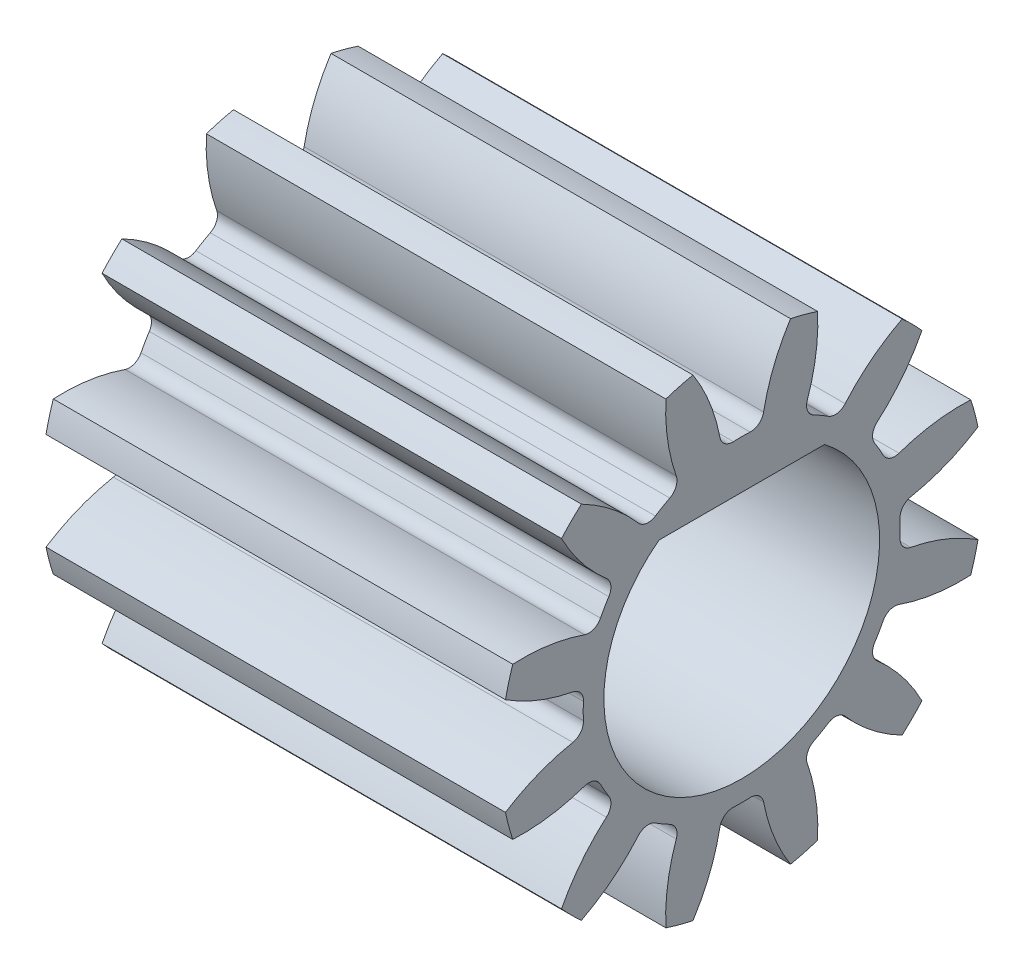
from build123d import *

# Parameters (mm, degrees)
SKETCH1_R                = 5.25
SKETCH1_R_2              = 3
BOSS_EXTRUDE2_DEPTH      = 10
CUT_EXTRUDE1_DEPTH       = 13.454918707
FILLET1_R                = 0.285
CIRPATTERN2_COUNT        = 12
FILLET1_OF_CIRPATTERN2_R = 0.285
BOSS_EXTRUDE3_DEPTH      = 10


with BuildPart() as part:
    # Sketch1 → Boss-Extrude2 (new body)
    with BuildSketch(Plane(origin=(0, 0, 0), x_dir=(0, 0, -1), z_dir=(1, 0, 0))):
        Circle(SKETCH1_R)
        Circle(SKETCH1_R_2, mode=Mode.SUBTRACT)
    extrude(amount=BOSS_EXTRUDE2_DEPTH)

    # Sketch3 → Cut-Extrude1 (cut, through all)
    with BuildSketch(Plane(origin=(10, 0, 0), x_dir=(0, 0, -1), z_dir=(1, 0, 0))):
        with BuildLine():
            ThreePointArc((0.435664459, 3.422381697), (0, 3.45), (-0.435664459, 3.422381697))
            ThreePointArc((-0.435664459, 3.422381697), (-0.652529527, 4.316927443), (-1.061404169, 5.141587419))
            ThreePointArc((-1.061404169, 5.141587419), (0, 5.25), (1.061404169, 5.141587419))
            ThreePointArc((1.061404169, 5.141587419), (0.652529527, 4.316927443), (0.435664459, 3.422381697))
        make_face()
    cut_extrude1 = extrude(amount=-CUT_EXTRUDE1_DEPTH, mode=Mode.SUBTRACT)

    # Fillet1
    fillet1_edges = [part.edges().sort_by_distance(p)[0] for p in [
        (5, 3.422381697, 0.435664459),
        (5, 3.422381697, -0.435664459),
    ]]
    fillet(fillet1_edges, radius=FILLET1_R)

    # CirPattern2: Cut-Extrude1 ×12 about axis
    cirpattern2_axis = Axis((0, 0, 0), (1, 0, 0))
    for i in range(1, CIRPATTERN2_COUNT):
        add(cut_extrude1.rotate(cirpattern2_axis, i * 360 / CIRPATTERN2_COUNT), mode=Mode.SUBTRACT)

    # Fillet1 of CirPattern2
    fillet1_of_cirpattern2_edges = [part.edges().sort_by_distance(p)[0] for p in [
        (5, 2.746037261, 2.088487338),
        (5, 3.181701721, 1.333894359),
        (5, 1.333894359, 3.181701721),
        (5, 2.088487338, 2.746037261),
        (5, -0.435664459, 3.422381697),
        (5, 0.435664459, 3.422381697),
        (5, -2.088487338, 2.746037261),
        (5, -1.333894359, 3.181701721),
        (5, -3.181701721, 1.333894359),
        (5, -2.746037261, 2.088487338),
        (5, -3.422381697, -0.435664459),
        (5, -3.422381697, 0.435664459),
        (5, -2.746037261, -2.088487338),
        (5, -3.181701721, -1.333894359),
        (5, -1.333894359, -3.181701721),
        (5, -2.088487338, -2.746037261),
        (5, 0.435664459, -3.422381697),
        (5, -0.435664459, -3.422381697),
        (5, 2.088487338, -2.746037261),
        (5, 1.333894359, -3.181701721),
        (5, 3.181701721, -1.333894359),
        (5, 2.746037261, -2.088487338),
    ]]
    fillet(fillet1_of_cirpattern2_edges, radius=FILLET1_OF_CIRPATTERN2_R)

    # Sketch4 → Boss-Extrude3 (add)
    with BuildSketch(Plane.ZY):
        with BuildLine():
            Line((-1.8, 2.4), (1.8, 2.4))
            ThreePointArc((1.8, 2.4), (0, 3), (-1.8, 2.4))
        make_face()
    extrude(amount=-BOSS_EXTRUDE3_DEPTH)


solid = part.part
